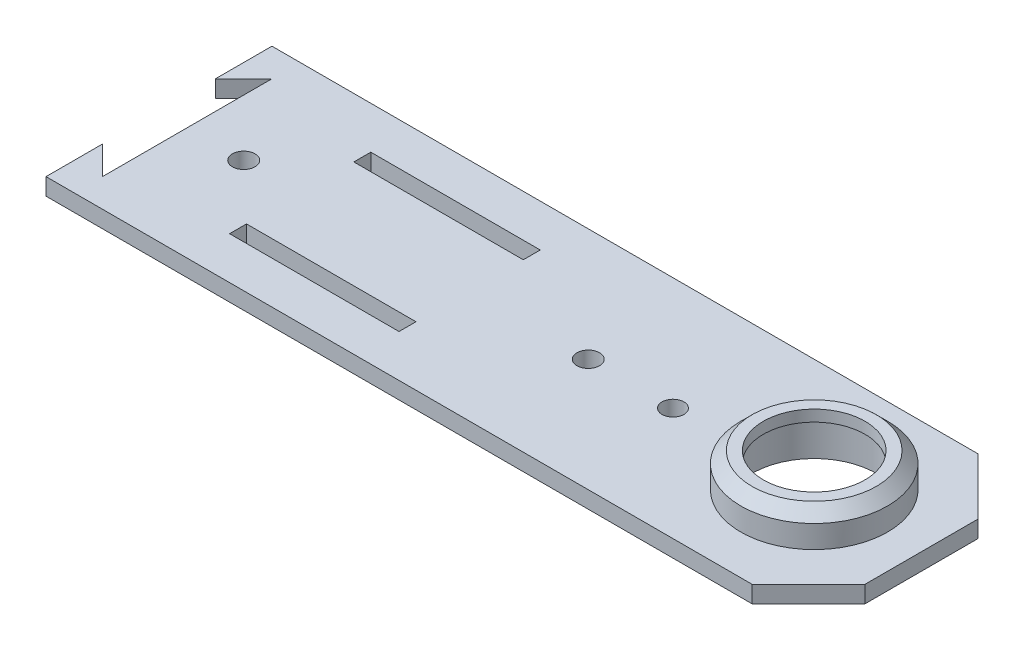
from build123d import *

# Parameters (mm, degrees)
CROQUIS1_R              = 11
CROQUIS1_R_2            = 2
CROQUIS1_R_3            = 1.937672591
CROQUIS1_W              = 30
CROQUIS1_H              = 3
SALIENTE_EXTRUIR1_DEPTH = 3
CROQUIS2_R              = 13
CROQUIS2_R_2            = 11
SALIENTE_EXTRUIR2_DEPTH = 4
CROQUIS3_R              = 13
CROQUIS3_R_2            = 9
SALIENTE_EXTRUIR3_DEPTH = 2
CHAFL_N1_SIZE           = 2
CHAFL_N2_SIZE           = 10


with BuildPart() as part:
    # Croquis1 → Saliente-Extruir1 (new body)
    with BuildSketch(Plane(origin=(0, 0, 0), x_dir=(1, 0, 0), z_dir=(0, 1, 0))):
        Polygon((-67.5, 10), (-62.5, 15), (-62.5, -15), (-67.5, -10), (-67.5, -20), (67.5, -20), (67.5, 20), (-67.5, 20), align=None)
        with Locations(Location((48.5, 0, 0), (0, 0, 270))):
            Circle(CROQUIS1_R, mode=Mode.SUBTRACT)
        with Locations(Location((-52.5, 0, 0), (0, 0, 270))):
            Circle(CROQUIS1_R_2, mode=Mode.SUBTRACT)
        with Locations(Location((23.5, 0, 0), (0, 0, 270))):
            Circle(CROQUIS1_R_3, mode=Mode.SUBTRACT)
        with Locations(Location((8.5, 0, 0), (0, 0, 270))):
            Circle(CROQUIS1_R_2, mode=Mode.SUBTRACT)
        with Locations((-27.5, 11)):
            Rectangle(CROQUIS1_W, CROQUIS1_H, mode=Mode.SUBTRACT)
        with Locations((-27.5, -11)):
            Rectangle(CROQUIS1_W, CROQUIS1_H, mode=Mode.SUBTRACT)
    extrude(amount=SALIENTE_EXTRUIR1_DEPTH)

    # Croquis2 → Saliente-Extruir2 (add)
    with BuildSketch(Plane(origin=(0, 3, 0), x_dir=(1, 0, 0), z_dir=(0, 1, 0))):
        with Locations(Location((48.5, 0, 0), (0, 0, 90))):
            Circle(CROQUIS2_R)
        with Locations(Location((48.5, 0, 0), (0, 0, 270))):
            Circle(CROQUIS2_R_2, mode=Mode.SUBTRACT)
    extrude(amount=SALIENTE_EXTRUIR2_DEPTH)

    # Croquis3 → Saliente-Extruir3 (add)
    with BuildSketch(Plane(origin=(0, 7, 0), x_dir=(1, 0, 0), z_dir=(0, 1, 0))):
        with Locations(Location((48.5, 0, 0), (0, 0, 90))):
            Circle(CROQUIS3_R)
        with Locations(Location((48.5, 0, 0), (0, 0, 270))):
            Circle(CROQUIS3_R_2, mode=Mode.SUBTRACT)
    extrude(amount=SALIENTE_EXTRUIR3_DEPTH)

    # Chaflán1
    chafl_n1_edges = [part.edges().sort_by_distance(p)[0] for p in [
        (48.5, 9, 13),
    ]]
    chamfer(chafl_n1_edges, length=CHAFL_N1_SIZE)

    # Chaflán2
    chafl_n2_edges = [part.edges().sort_by_distance(p)[0] for p in [
        (67.5, 1.5, 20),
        (67.5, 1.5, -20),
    ]]
    chamfer(chafl_n2_edges, length=CHAFL_N2_SIZE)


solid = part.part
